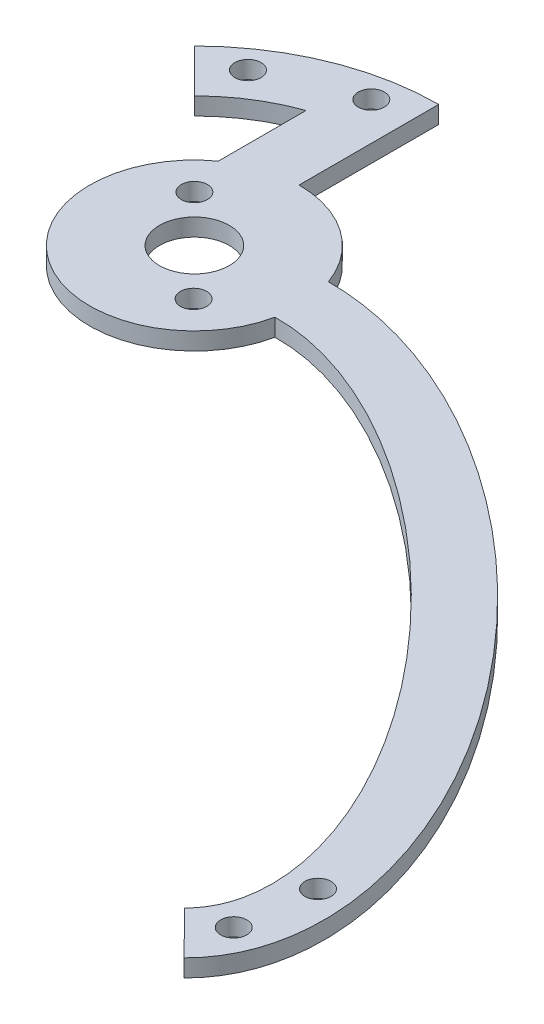
from build123d import *

# Parameters (mm, degrees)
SKETCH_1_R          = 4
SKETCH_1_R_2        = 1.5
EXTRUDE_1_DEPTH     = 2
SKETCH_2_R          = 1.5
CUT_EXTRUDE_2_DEPTH = 104.059617002


with BuildPart() as part:
    # Эскиз1 → Бобышка-Вытянуть1 (new body)
    with BuildSketch(Plane(origin=(0, 0, 0), x_dir=(1, 0, 0), z_dir=(0, 1, 0))):
        with BuildLine():
            Line((0, 22), (0, 28))
            ThreePointArc((0, 28), (-10.715136106, 25.86862691), (-19.798989873, 19.798989873))
            Line((-19.798989873, 19.798989873), (-14.849242405, 14.849242405))
            ThreePointArc((-14.849242405, 14.849242405), (-11.201444033, 17.763098029), (-7, 19.798989873))
            Line((-7, 19.798989873), (-7, 9.746794345))
            ThreePointArc((-7, 9.746794345), (-6.564948769, -10.044971262), (11.736941311, -2.498841464))
            add(Edge.make_bspline(
                [(65.204375733, -66.312814639), (75.825202802, -55.869517931), (53.305164418, -28.991603535), (30.785126033, -2.11368914), (11.736941311, -2.498841464)],
                knots=[3.141592654, 3.141592654, 3.141592654, 4.52417168, 4.52417168, 5.906750707, 5.906750707, 5.906750707], degree=2, weights=[1, 0.770424551, 1, 0.770424551, 1]))
            Line((65.204375733, -66.312814639), (70.112231971, -71.304101762))
            add(Edge.make_bspline(
                [(70.112231971, -71.304101762), (84.309208097, -57.344432418), (60.27488535, -26.546674616), (36.240562602, 4.251083187), (11.286847169, 4.075178643)],
                knots=[0, 0, 0, 1.345106543, 1.345106543, 2.690213086, 2.690213086, 2.690213086], degree=2, weights=[1, 0.782233567, 1, 0.782233567, 1]))
            ThreePointArc((11.286847169, 4.075178643), (6.895573083, 9.82095066), (0, 12))
            Line((0, 12), (0, 22))
        make_face()
        with Locations(Location((0, 0, 0), (0, 0, 270))):
            Circle(SKETCH_1_R, mode=Mode.SUBTRACT)
        with Locations(Location((-5.303300859, 5.303300859, 0), (0, 0, 270))):
            Circle(SKETCH_1_R_2, mode=Mode.SUBTRACT)
        with Locations(Location((5.258417398, -5.347807632, 0), (0, 0, 270))):
            Circle(SKETCH_1_R_2, mode=Mode.SUBTRACT)
    extrude(amount=EXTRUDE_1_DEPTH)

    # Эскиз2 → Вырез-Вытянуть2 (cut, through all)
    with BuildSketch(Plane(origin=(0, 2, 0), x_dir=(1, 0, 0), z_dir=(0, 1, 0))):
        with Locations(Location((-4.341204442, 24.620193825, 0), (0, 0, 270))):
            Circle(SKETCH_2_R)
        with Locations(Location((-14.339410909, 20.478801107, 0), (0, 0, 90))):
            Circle(SKETCH_2_R)
        with Locations(Location((70.950669671, -56.781116903, 0), (0, 0, 270))):
            Circle(SKETCH_2_R)
        with Locations(Location((69.940110878, -65.427777819, 0), (0, 0, 270))):
            Circle(SKETCH_2_R)
    extrude(amount=-CUT_EXTRUDE_2_DEPTH, mode=Mode.SUBTRACT)


solid = part.part
